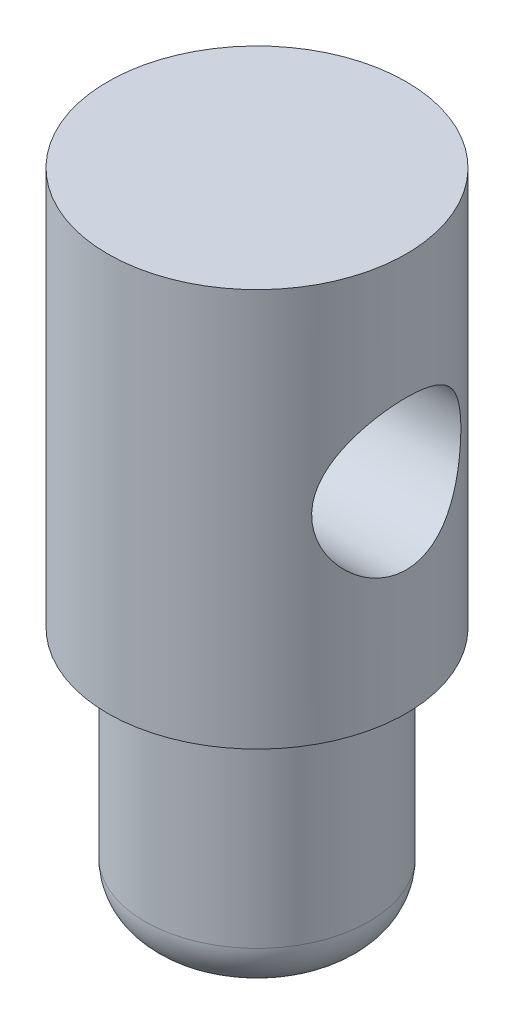
from build123d import *

# Parameters (mm, degrees)
SKETCH1_R               = 3
BOSS_EXTRUDE1_DEPTH     = 2
SKETCH1_4_R             = 3
BOSS_EXTRUDE2_DEPTH     = 8
SKETCH1_5_R             = 2.25
BOSS_EXTRUDE3_DEPTH     = 5
CUT_EXTRUDE1_DEPTH      = 10.055385138
CUT_EXTRUDE1_DEPTH_BACK = 10.055385138
SKETCH2_R               = 1.5
FILLET1_R               = 1


with BuildPart() as part:
    # Sketch1 → Boss-Extrude1 (new body)
    with BuildSketch(Plane(origin=(0, 0, 0), x_dir=(1, 0, 0), z_dir=(0, 1, 0))):
        Circle(SKETCH1_R)
        with BuildLine():
            Line((1.5, 1.677050983), (1.5, -1.677050983))
            ThreePointArc((1.5, -1.677050983), (0, -2.25), (-1.5, -1.677050983))
            Line((-1.5, -1.677050983), (-1.5, 1.677050983))
            ThreePointArc((-1.5, 1.677050983), (0, 2.25), (1.5, 1.677050983))
        make_face(mode=Mode.SUBTRACT)
    extrude(amount=BOSS_EXTRUDE1_DEPTH)

    # Sketch1<4> → Boss-Extrude2 (add)
    with BuildSketch(Plane(origin=(0, 0, 0), x_dir=(1, 0, 0), z_dir=(0, 1, 0))):
        Circle(SKETCH1_4_R)
    extrude(amount=BOSS_EXTRUDE2_DEPTH)

    # Sketch1<5> → Boss-Extrude3 (add)
    with BuildSketch(Plane(origin=(0, 0, 0), x_dir=(1, 0, 0), z_dir=(0, 1, 0))):
        Circle(SKETCH1_5_R)
    extrude(amount=-BOSS_EXTRUDE3_DEPTH)

    # Sketch2 → Cut-Extrude1 (cut, two sides: drawn at the far end of the back side and taken through both)
    with BuildSketch(Plane(origin=(0, 0, 0), x_dir=(0, 0, -1), z_dir=(1, 0, 0)).offset(-CUT_EXTRUDE1_DEPTH_BACK)):
        with Locations((0, 4)):
            Circle(SKETCH2_R)
    extrude(amount=CUT_EXTRUDE1_DEPTH + CUT_EXTRUDE1_DEPTH_BACK, mode=Mode.SUBTRACT)

    # Fillet1
    fillet1_edges = [part.edges().sort_by_distance(p)[0] for p in [
        (-2.25, -5, 0),
    ]]
    fillet(fillet1_edges, radius=FILLET1_R)


solid = part.part
